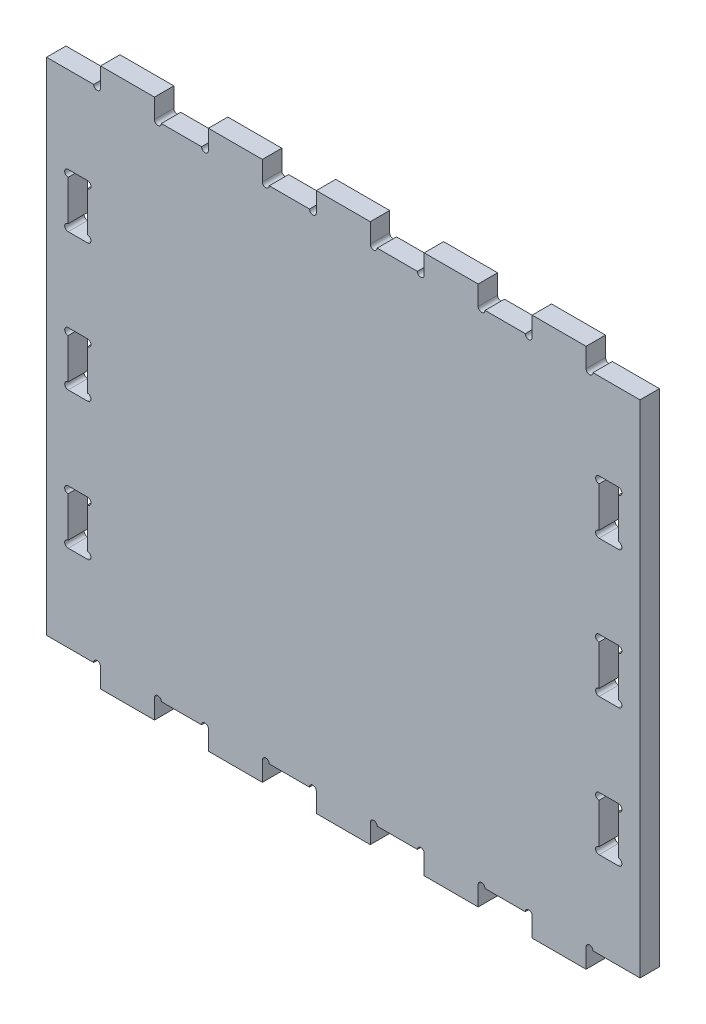
from build123d import *

# Parameters (mm, degrees)
ESTRUSIONE_ESTRUSIONE1_DEPTH = 18
TAGLIO_ESTRUSIONE1_DEPTH     = 47
TAGLIO_ESTRUSIONE2_DEPTH     = 32
TAGLIO_ESTRUSIONE3_DEPTH     = 50
TAGLIO_ESTRUSIONE4_DEPTH     = 44
TAGLIO_ESTRUSIONE5_DEPTH     = 38
TAGLIO_ESTRUSIONE6_DEPTH     = 44


with BuildPart() as part:
    # Model → Estrusione-Estrusione1 (new body)
    with BuildSketch(Plane.XY):
        with BuildLine():
            Line((-275, -232), (-275, 232))
            Line((-275, 232), (-231.35, 232))
            ThreePointArc((-231.35, 232), (-228.175, 228.825), (-225, 232))
            Line((-225, 232), (-225, 250))
            Line((-225, 250), (-175, 250))
            Line((-175, 250), (-175, 232))
            ThreePointArc((-175, 232), (-171.825, 228.825), (-168.65, 232))
            Line((-168.65, 232), (-131.35, 232))
            ThreePointArc((-131.35, 232), (-128.175, 228.825), (-125, 232))
            Line((-125, 232), (-125, 250))
            Line((-125, 250), (-75, 250))
            Line((-75, 250), (-75, 232))
            ThreePointArc((-75, 232), (-71.825, 228.825), (-68.65, 232))
            Line((-68.65, 232), (-31.35, 232))
            ThreePointArc((-31.35, 232), (-28.175, 228.825), (-25, 232))
            Line((-25, 232), (-25, 250))
            Line((-25, 250), (25, 250))
            Line((25, 250), (25, 232))
            ThreePointArc((25, 232), (28.175, 228.825), (31.35, 232))
            Line((31.35, 232), (68.65, 232))
            ThreePointArc((68.65, 232), (71.825, 228.825), (75, 232))
            Line((75, 232), (75, 250))
            Line((75, 250), (125, 250))
            Line((125, 250), (125, 232))
            ThreePointArc((125, 232), (128.175, 228.825), (131.35, 232))
            Line((131.35, 232), (168.65, 232))
            ThreePointArc((168.65, 232), (171.825, 228.825), (175, 232))
            Line((175, 232), (175, 250))
            Line((175, 250), (225, 250))
            Line((225, 250), (225, 232))
            ThreePointArc((225, 232), (228.175, 228.825), (231.35, 232))
            Line((231.35, 232), (275, 232))
            Line((275, 232), (275, -232))
            Line((275, -232), (231.35, -232))
            ThreePointArc((231.35, -232), (228.175, -228.825), (225, -232))
            Line((225, -232), (225, -250))
            Line((225, -250), (175, -250))
            Line((175, -250), (175, -232))
            ThreePointArc((175, -232), (171.825, -228.825), (168.65, -232))
            Line((168.65, -232), (131.35, -232))
            ThreePointArc((131.35, -232), (128.175, -228.825), (125, -232))
            Line((125, -232), (125, -250))
            Line((125, -250), (75, -250))
            Line((75, -250), (75, -232))
            ThreePointArc((75, -232), (71.825, -228.825), (68.65, -232))
            Line((68.65, -232), (31.35, -232))
            ThreePointArc((31.35, -232), (28.175, -228.825), (25, -232))
            Line((25, -232), (25, -250))
            Line((25, -250), (-25, -250))
            Line((-25, -250), (-25, -232))
            ThreePointArc((-25, -232), (-28.175, -228.825), (-31.35, -232))
            Line((-31.35, -232), (-68.65, -232))
            ThreePointArc((-68.65, -232), (-71.825, -228.825), (-75, -232))
            Line((-75, -232), (-75, -250))
            Line((-75, -250), (-125, -250))
            Line((-125, -250), (-125, -232))
            ThreePointArc((-125, -232), (-128.175, -228.825), (-131.35, -232))
            Line((-131.35, -232), (-168.65, -232))
            ThreePointArc((-168.65, -232), (-171.825, -228.825), (-175, -232))
            Line((-175, -232), (-175, -250))
            Line((-175, -250), (-225, -250))
            Line((-225, -250), (-225, -232))
            ThreePointArc((-225, -232), (-228.175, -228.825), (-231.35, -232))
            Line((-231.35, -232), (-275, -232))
        make_face()
    extrude(amount=ESTRUSIONE_ESTRUSIONE1_DEPTH)

    # Model<3> → Taglio-Estrusione1 (cut)
    with BuildSketch(Plane.XY):
        with BuildLine():
            Line((-255, 145.65), (-255, 108.35))
            ThreePointArc((-255, 108.35), (-258.175, 105.175), (-255, 102))
            Line((-255, 102), (-237, 102))
            ThreePointArc((-237, 102), (-233.825, 105.175), (-237, 108.35))
            Line((-237, 108.35), (-237, 145.65))
            ThreePointArc((-237, 145.65), (-233.825, 148.825), (-237, 152))
            Line((-237, 152), (-255, 152))
            ThreePointArc((-255, 152), (-258.175, 148.825), (-255, 145.65))
        make_face()
    extrude(amount=TAGLIO_ESTRUSIONE1_DEPTH, mode=Mode.SUBTRACT)

    # Model<4> → Taglio-Estrusione2 (cut)
    with BuildSketch(Plane.XY):
        with BuildLine():
            Line((-255, -18.65), (-255, 18.65))
            ThreePointArc((-255, 18.65), (-258.175, 21.825), (-255, 25))
            Line((-255, 25), (-237, 25))
            ThreePointArc((-237, 25), (-233.825, 21.825), (-237, 18.65))
            Line((-237, 18.65), (-237, -18.65))
            ThreePointArc((-237, -18.65), (-233.825, -21.825), (-237, -25))
            Line((-237, -25), (-255, -25))
            ThreePointArc((-255, -25), (-258.175, -21.825), (-255, -18.65))
        make_face()
    extrude(amount=TAGLIO_ESTRUSIONE2_DEPTH, mode=Mode.SUBTRACT)

    # Model<5> → Taglio-Estrusione3 (cut)
    with BuildSketch(Plane.XY):
        with BuildLine():
            Line((-255, -145.65), (-255, -108.35))
            ThreePointArc((-255, -108.35), (-258.175, -105.175), (-255, -102))
            Line((-255, -102), (-237, -102))
            ThreePointArc((-237, -102), (-233.825, -105.175), (-237, -108.35))
            Line((-237, -108.35), (-237, -145.65))
            ThreePointArc((-237, -145.65), (-233.825, -148.825), (-237, -152))
            Line((-237, -152), (-255, -152))
            ThreePointArc((-255, -152), (-258.175, -148.825), (-255, -145.65))
        make_face()
    extrude(amount=TAGLIO_ESTRUSIONE3_DEPTH, mode=Mode.SUBTRACT)

    # Model<6> → Taglio-Estrusione4 (cut)
    with BuildSketch(Plane.XY):
        with BuildLine():
            Line((237, 145.65), (237, 108.35))
            ThreePointArc((237, 108.35), (233.825, 105.175), (237, 102))
            Line((237, 102), (255, 102))
            ThreePointArc((255, 102), (258.175, 105.175), (255, 108.35))
            Line((255, 108.35), (255, 145.65))
            ThreePointArc((255, 145.65), (258.175, 148.825), (255, 152))
            Line((255, 152), (237, 152))
            ThreePointArc((237, 152), (233.825, 148.825), (237, 145.65))
        make_face()
    extrude(amount=TAGLIO_ESTRUSIONE4_DEPTH, mode=Mode.SUBTRACT)

    # Model<7> → Taglio-Estrusione5 (cut)
    with BuildSketch(Plane.XY):
        with BuildLine():
            Line((237, -18.65), (237, 18.65))
            ThreePointArc((237, 18.65), (233.825, 21.825), (237, 25))
            Line((237, 25), (255, 25))
            ThreePointArc((255, 25), (258.175, 21.825), (255, 18.65))
            Line((255, 18.65), (255, -18.65))
            ThreePointArc((255, -18.65), (258.175, -21.825), (255, -25))
            Line((255, -25), (237, -25))
            ThreePointArc((237, -25), (233.825, -21.825), (237, -18.65))
        make_face()
    extrude(amount=TAGLIO_ESTRUSIONE5_DEPTH, mode=Mode.SUBTRACT)

    # Model<10> → Taglio-Estrusione6 (cut)
    with BuildSketch(Plane.XY):
        with BuildLine():
            Line((237, -145.65), (237, -108.35))
            ThreePointArc((237, -108.35), (233.825, -105.175), (237, -102))
            Line((237, -102), (255, -102))
            ThreePointArc((255, -102), (258.175, -105.175), (255, -108.35))
            Line((255, -108.35), (255, -145.65))
            ThreePointArc((255, -145.65), (258.175, -148.825), (255, -152))
            Line((255, -152), (237, -152))
            ThreePointArc((237, -152), (233.825, -148.825), (237, -145.65))
        make_face()
    extrude(amount=TAGLIO_ESTRUSIONE6_DEPTH, mode=Mode.SUBTRACT)


solid = part.part
